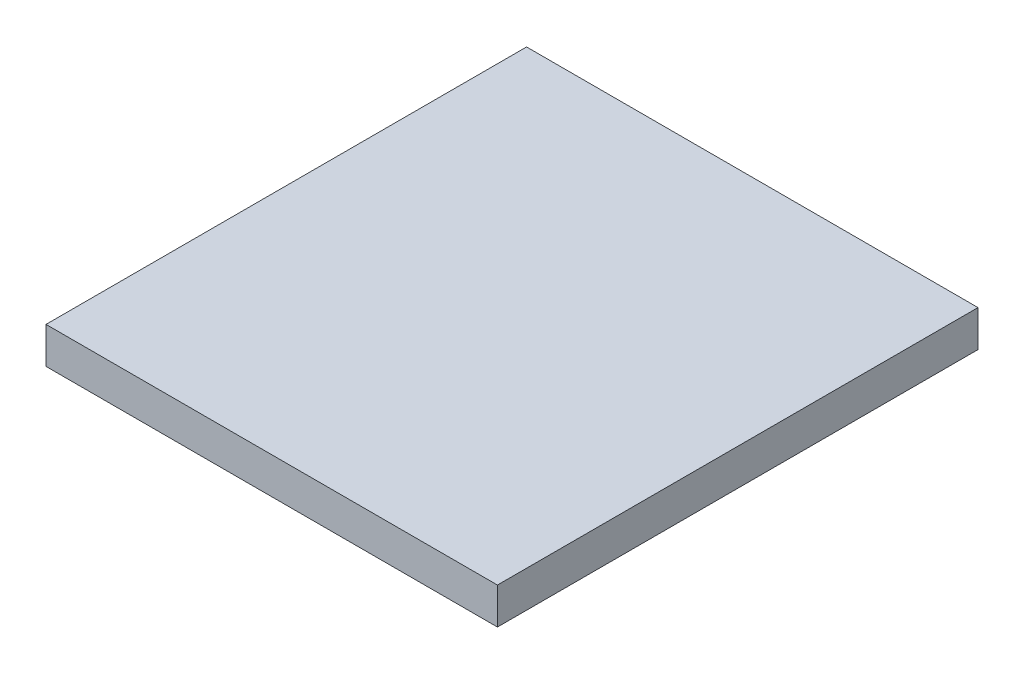
from build123d import *

# Parameters (mm, degrees)
SKETCH1_W           = 62
SKETCH1_H           = 66
BOSS_EXTRUDE1_DEPTH = 5


with BuildPart() as part:
    # Sketch1 → Boss-Extrude1 (new body)
    with BuildSketch(Plane(origin=(0, 0, 0), x_dir=(1, 0, 0), z_dir=(0, 1, 0))):
        with Locations((31, 33)):
            Rectangle(SKETCH1_W, SKETCH1_H)
    extrude(amount=BOSS_EXTRUDE1_DEPTH)


solid = part.part
